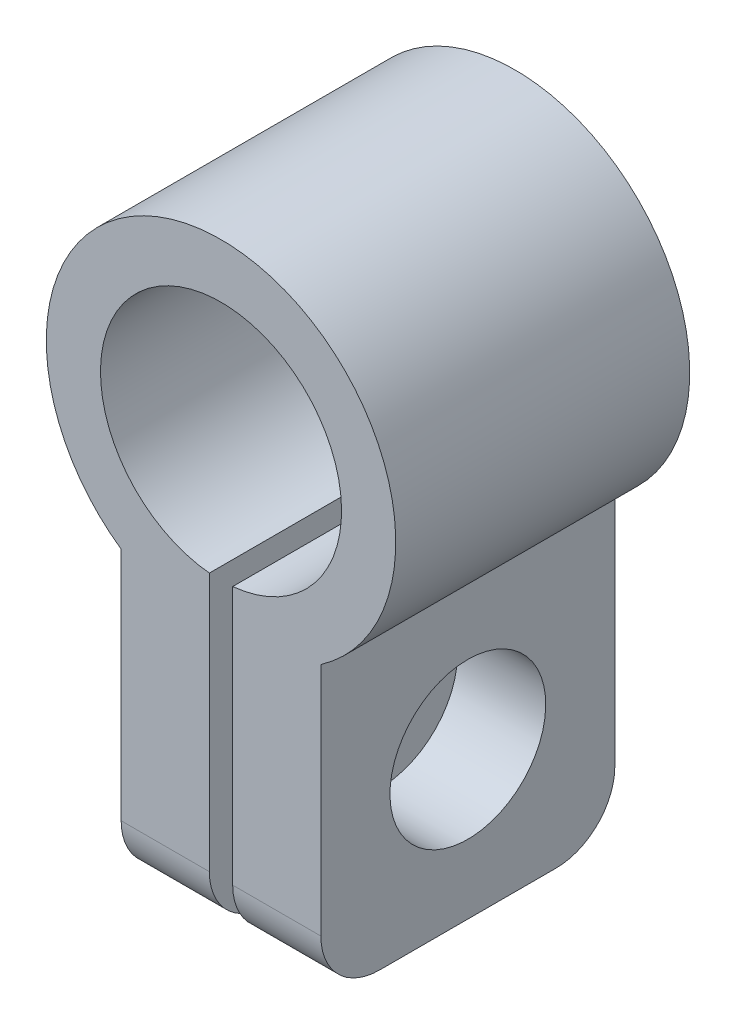
from build123d import *

# Parameters (mm, degrees)
BOSS_EXTRUDE1_DEPTH = 10
CUT_EXTRUDE1_DEPTH  = 10
FILLET1_R           = 2


with BuildPart() as part:
    # Sketch1 → Boss-Extrude1 (new body)
    with BuildSketch(Plane.XY):
        with BuildLine():
            Line((-0.39684881, -4.080748831), (-0.39684881, -14.87796999))
            Line((-0.39684881, -14.87796999), (-3.39684881, -14.87796999))
            Line((-3.39684881, -14.87796999), (-3.39684881, -4.87796999))
            ThreePointArc((-3.39684881, -4.87796999), (0, 5.944171352), (3.39684881, -4.87796999))
            Line((3.39684881, -4.87796999), (3.39684881, -14.87796999))
            Line((3.39684881, -14.87796999), (0.39684881, -14.87796999))
            Line((0.39684881, -14.87796999), (0.39684881, -4.080748831))
            ThreePointArc((0.39684881, -4.080748831), (0, 4.1), (-0.39684881, -4.080748831))
        make_face()
    extrude(amount=BOSS_EXTRUDE1_DEPTH)

    # Sketch2 → Cut-Extrude1 (cut)
    with BuildSketch(Plane(origin=(3.39684881, 0, 0), x_dir=(0, 0, -1), z_dir=(1, 0, 0))):
        with BuildLine():
            ThreePointArc((-3.12616703, -8.004137019), (-6.87383297, -8.004137019), (-6.87383297, -11.75180296))
            Line((-6.87383297, -11.75180296), (-3.12616703, -8.004137019))
        make_face()
        with BuildLine():
            Line((-3.12616703, -8.004137019), (-6.87383297, -11.75180296))
            ThreePointArc((-6.87383297, -11.75180296), (-3.985888904, -12.326250751), (-2.35, -9.87796999))
            ThreePointArc((-2.35, -9.87796999), (-2.551719239, -8.863858894), (-3.12616703, -8.004137019))
        make_face()
    extrude(amount=-CUT_EXTRUDE1_DEPTH, mode=Mode.SUBTRACT)

    # Fillet1
    fillet1_edges = [part.edges().sort_by_distance(p)[0] for p in [
        (1.89684881, -14.87796999, 0),
        (1.89684881, -14.87796999, 10),
        (-1.89684881, -14.87796999, 10),
        (-1.89684881, -14.87796999, 0),
    ]]
    fillet(fillet1_edges, radius=FILLET1_R)


solid = part.part
